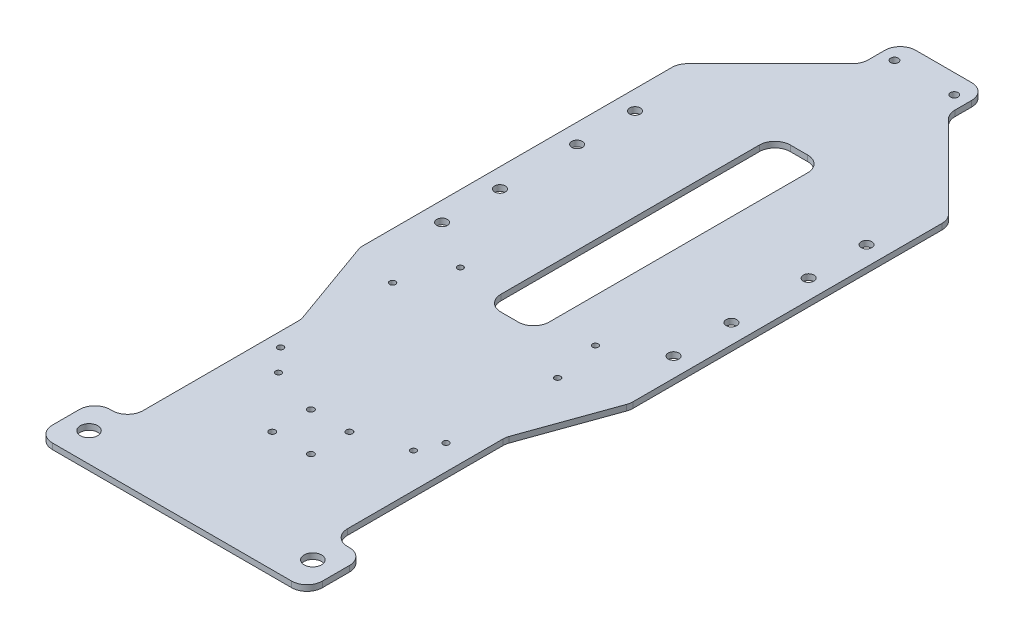
from build123d import *

# Parameters (mm, degrees)
BOSS_EXTRUDE2_DEPTH     = 3
SKETCH2_R               = 4.5
SKETCH2_R_2             = 2
SKETCH2_R_3             = 2.75
SKETCH2_W               = 25
SKETCH2_H               = 150
CUT_EXTRUDE1_DEPTH      = 10
FILLET1_R               = 8
CUT_EXTRUDE2_DEPTH      = 424.803020282
CUT_EXTRUDE2_DEPTH_BACK = 424.803020282
SKETCH3_R               = 1.65
M2_5_CLEARANCE_HOLE_D   = 3.1


with BuildPart() as part:
    # Sketch1 → Boss-Extrude2 (new body)
    with BuildSketch(Plane(origin=(0, 0, 0), x_dir=(1, 0, 0), z_dir=(0, 1, 0))):
        Polygon((47.5, 400), (92.5, 400), (92.5, 380), (140, 332.5), (140, 167.5), (123, 120), (123, 30), (140, 30), (140, 0), (0, 0), (0, 30), (17, 30), (17, 120), (0, 167.5), (0, 332.5), (47.5, 380), align=None)
    extrude(amount=BOSS_EXTRUDE2_DEPTH)

    # Sketch2 → Cut-Extrude1 (cut)
    with BuildSketch(Plane(origin=(0, 3, 0), x_dir=(1, 0, 0), z_dir=(0, 1, 0))):
        with Locations(Location((12, 15, 0), (0, 0, 270))):
            Circle(SKETCH2_R)
        with Locations(Location((128, 15, 0), (0, 0, 270))):
            Circle(SKETCH2_R)
        with Locations(Location((54.5, 390, 0), (0, 0, 270))):
            Circle(SKETCH2_R_2)
        with Locations(Location((85.5, 390, 0), (0, 0, 270))):
            Circle(SKETCH2_R_2)
        with Locations(Location((10, 270, 0), (0, 0, 270))):
            Circle(SKETCH2_R_3)
        with Locations(Location((10, 300, 0), (0, 0, 270))):
            Circle(SKETCH2_R_3)
        with Locations(Location((10, 230, 0), (0, 0, 270))):
            Circle(SKETCH2_R_3)
        with Locations(Location((10, 200, 0), (0, 0, 270))):
            Circle(SKETCH2_R_3)
        with Locations(Location((130, 270, 0), (0, 0, 270))):
            Circle(SKETCH2_R_3)
        with Locations(Location((130, 300, 0), (0, 0, 270))):
            Circle(SKETCH2_R_3)
        with Locations(Location((130, 230, 0), (0, 0, 270))):
            Circle(SKETCH2_R_3)
        with Locations(Location((130, 200, 0), (0, 0, 270))):
            Circle(SKETCH2_R_3)
        with Locations((70, 250)):
            Rectangle(SKETCH2_W, SKETCH2_H)
    extrude(amount=-CUT_EXTRUDE1_DEPTH, mode=Mode.SUBTRACT)

    # Fillet1
    fillet1_edges = [part.edges().sort_by_distance(p)[0] for p in [
        (0, 1.5, -167.5),
        (0, 1.5, -332.5),
        (47.5, 1.5, -380),
        (47.5, 1.5, -400),
        (92.5, 1.5, -400),
        (92.5, 1.5, -380),
        (140, 1.5, -332.5),
        (140, 1.5, -167.5),
        (123, 1.5, -120),
        (123, 1.5, -30),
        (140, 1.5, -30),
        (140, 1.5, 0),
        (0, 1.5, 0),
        (0, 1.5, -30),
        (17, 1.5, -30),
        (17, 1.5, -120),
        (82.5, 1.5, -325),
        (82.5, 1.5, -175),
        (57.5, 1.5, -175),
        (57.5, 1.5, -325),
    ]]
    fillet(fillet1_edges, radius=FILLET1_R)

    # Sketch3 → Cut-Extrude2 (cut, two sides: drawn at the far end of the back side and taken through both)
    with BuildSketch(Plane(origin=(0, 3, 0), x_dir=(1, 0, 0), z_dir=(0, 1, 0)).offset(-CUT_EXTRUDE2_DEPTH_BACK)):
        with Locations(Location((60, 61.981063417, 0), (0, 0, 270))):
            Circle(SKETCH3_R)
        with Locations(Location((80, 61.981063417, 0), (0, 0, 270))):
            Circle(SKETCH3_R)
        with Locations(Location((80, 81.981063417, 0), (0, 0, 270))):
            Circle(SKETCH3_R)
        with Locations(Location((60, 81.981063417, 0), (0, 0, 270))):
            Circle(SKETCH3_R)
        with BuildLine():
            add(Edge.make_bspline(
                [(106.5, 184.471961437), (106.5, 187.471961437), (103.5, 187.471961437), (103.5, 184.471961437), (103.5, 181.471961437), (106.5, 181.471961437), (106.5, 184.471961437)],
                knots=[0, 0, 0, 0, 0.5, 0.5, 0.5, 1, 1, 1, 1], degree=3, weights=[1, 0.333333333, 0.333333333, 1, 0.333333333, 0.333333333, 1]))
        make_face()
        with BuildLine():
            add(Edge.make_bspline(
                [(36.5, 184.471961437), (36.5, 187.471961437), (33.5, 187.471961437), (33.5, 184.471961437), (33.5, 181.471961437), (36.5, 181.471961437), (36.5, 184.471961437)],
                knots=[0, 0, 0, 0, 0.5, 0.5, 0.5, 1, 1, 1, 1], degree=3, weights=[1, 0.333333333, 0.333333333, 1, 0.333333333, 0.333333333, 1]))
        make_face()
        with BuildLine():
            add(Edge.make_bspline(
                [(36.5, 90.161385117), (36.5, 93.161385117), (33.5, 93.161385117), (33.5, 90.161385117), (33.5, 87.161385117), (36.5, 87.161385117), (36.5, 90.161385117)],
                knots=[0, 0, 0, 0, 0.5, 0.5, 0.5, 1, 1, 1, 1], degree=3, weights=[1, 0.333333333, 0.333333333, 1, 0.333333333, 0.333333333, 1]))
        make_face()
        with BuildLine():
            add(Edge.make_bspline(
                [(106.5, 90.161385117), (106.5, 93.161385117), (103.5, 93.161385117), (103.5, 90.161385117), (103.5, 87.161385117), (106.5, 87.161385117), (106.5, 90.161385117)],
                knots=[0, 0, 0, 0, 0.5, 0.5, 0.5, 1, 1, 1, 1], degree=3, weights=[1, 0.333333333, 0.333333333, 1, 0.333333333, 0.333333333, 1]))
        make_face()
    extrude(amount=CUT_EXTRUDE2_DEPTH + CUT_EXTRUDE2_DEPTH_BACK, mode=Mode.SUBTRACT)

    # M2.5 Clearance Hole (through all)
    with Locations(Plane(origin=(-64.303791429, -30.85004355, -517.925787664), x_dir=(-0.9999999999999992, 3.8417372042051194e-08, -5.6284000436861274e-15), z_dir=(-3.841737204205161e-08, -0.9999999999999886, 1.4650663865100632e-07))):
        with Locations((-174.053067135, -357.800437947), (-88.583664633, -357.844523857), (-88.583664633, -415.917850605), (-174.339394801, -415.917850605)):
            Hole(M2_5_CLEARANCE_HOLE_D / 2)


solid = part.part
